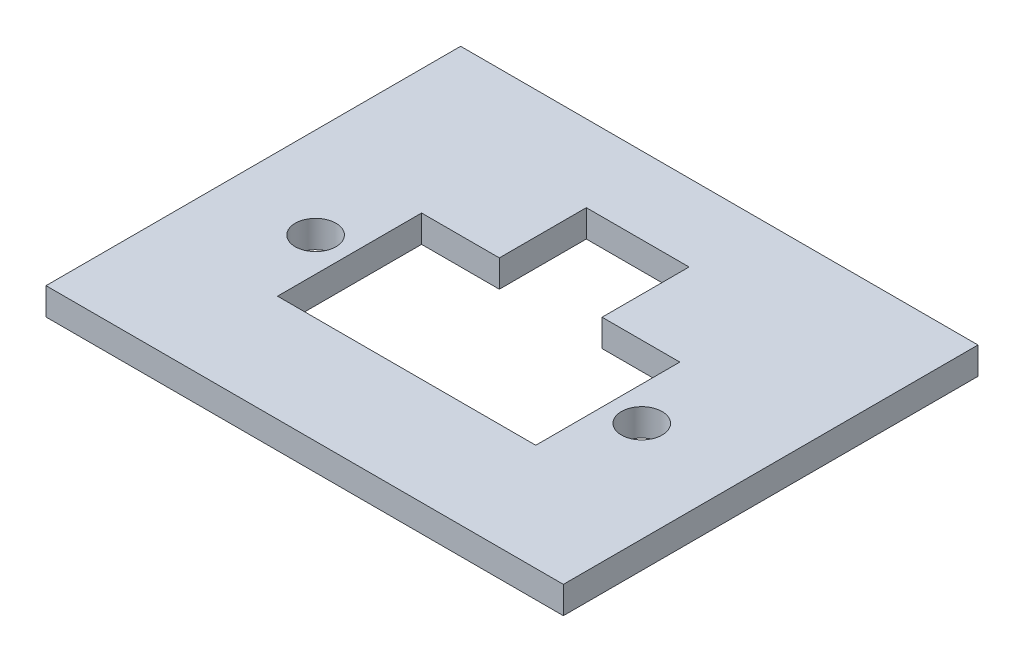
from build123d import *

# Parameters (mm, degrees)
SKETCH1_W           = 38.06737889
SKETCH1_H           = 30.508545283
SKETCH1_R           = 1.5
SKETCH1_W_2         = 19
SKETCH1_H_2         = 19
SKETCH1_W_3         = 5.72
SKETCH1_H_3         = 4.4
BOSS_EXTRUDE1_DEPTH = 2
SKETCH2_W           = 5.72
SKETCH2_H           = 2
SKETCH2_W_2         = 19
BOSS_EXTRUDE2_DEPTH = 2
SKETCH4_W           = 5.306249276
SKETCH4_H           = 7.407734137
SKETCH4_W_2         = 4.41311821
SKETCH4_H_2         = 5.936694734
BOSS_EXTRUDE3_DEPTH = 2
SKETCH5_R           = 1.5
CUT_EXTRUDE1_DEPTH  = 10


with BuildPart() as part:
    # Sketch1 → Boss-Extrude1 (new body)
    # profile 1 of 3: a face of its own
    with BuildSketch(Plane(origin=(0, 0, 0), x_dir=(1, 0, 0), z_dir=(0, 1, 0))):
        with Locations((-9.154760873, 9.406137061)):
            Rectangle(SKETCH1_W, SKETCH1_H)
        with Locations(Location((-21.5, 7.875, 0), (0, 0, 270))):
            Circle(SKETCH1_R, mode=Mode.SUBTRACT)
        with Locations(Location((2.5, 7.875, 0), (0, 0, 270))):
            Circle(SKETCH1_R, mode=Mode.SUBTRACT)
        with Locations((-9.5, 9.5)):
            Rectangle(SKETCH1_W_2, SKETCH1_H_2, mode=Mode.SUBTRACT)
    # profile 2 of 3: a face of its own
    with BuildSketch(Plane(origin=(0, 0, 0), x_dir=(1, 0, 0), z_dir=(0, 1, 0))):
        with Locations((-16.14, 16.8)):
            Rectangle(SKETCH1_W_3, SKETCH1_H_3)
    # profile 3 of 3: a face of its own
    with BuildSketch(Plane(origin=(0, 0, 0), x_dir=(1, 0, 0), z_dir=(0, 1, 0))):
        with Locations((-2.86, 16.8)):
            Rectangle(SKETCH1_W_3, SKETCH1_H_3)
    extrude(amount=BOSS_EXTRUDE1_DEPTH)

    # Sketch2 → Boss-Extrude2 (add)
    with BuildSketch(Plane.XZ):
        with Locations((-16.14, -13.6)):
            Rectangle(SKETCH2_W, SKETCH2_H)
        with Locations((-2.86, -13.6)):
            Rectangle(SKETCH2_W, SKETCH2_H)
        with Locations((-9.5, -1)):
            Rectangle(SKETCH2_W_2, SKETCH2_H)
    extrude(amount=-BOSS_EXTRUDE2_DEPTH)

    # Sketch4 → Boss-Extrude3 (add)
    with BuildSketch(Plane(origin=(0, 2, 0), x_dir=(1, 0, 0), z_dir=(0, 1, 0))):
        with Locations((-22.157698454, 8.69688592)):
            Rectangle(SKETCH4_W, SKETCH4_H)
        with Locations((2.928777081, 8.329126069)):
            Rectangle(SKETCH4_W_2, SKETCH4_H_2)
    extrude(amount=-BOSS_EXTRUDE3_DEPTH)

    # Sketch5 → Cut-Extrude1 (cut)
    with BuildSketch(Plane(origin=(0, 2, 0), x_dir=(1, 0, 0), z_dir=(0, 1, 0))):
        with Locations(Location((-21.5, 7.3, 0), (0, 0, 270))):
            Circle(SKETCH5_R)
        with Locations(Location((2.5, 7.3, 0), (0, 0, 270))):
            Circle(SKETCH5_R)
    extrude(amount=-CUT_EXTRUDE1_DEPTH, mode=Mode.SUBTRACT)


solid = part.part
